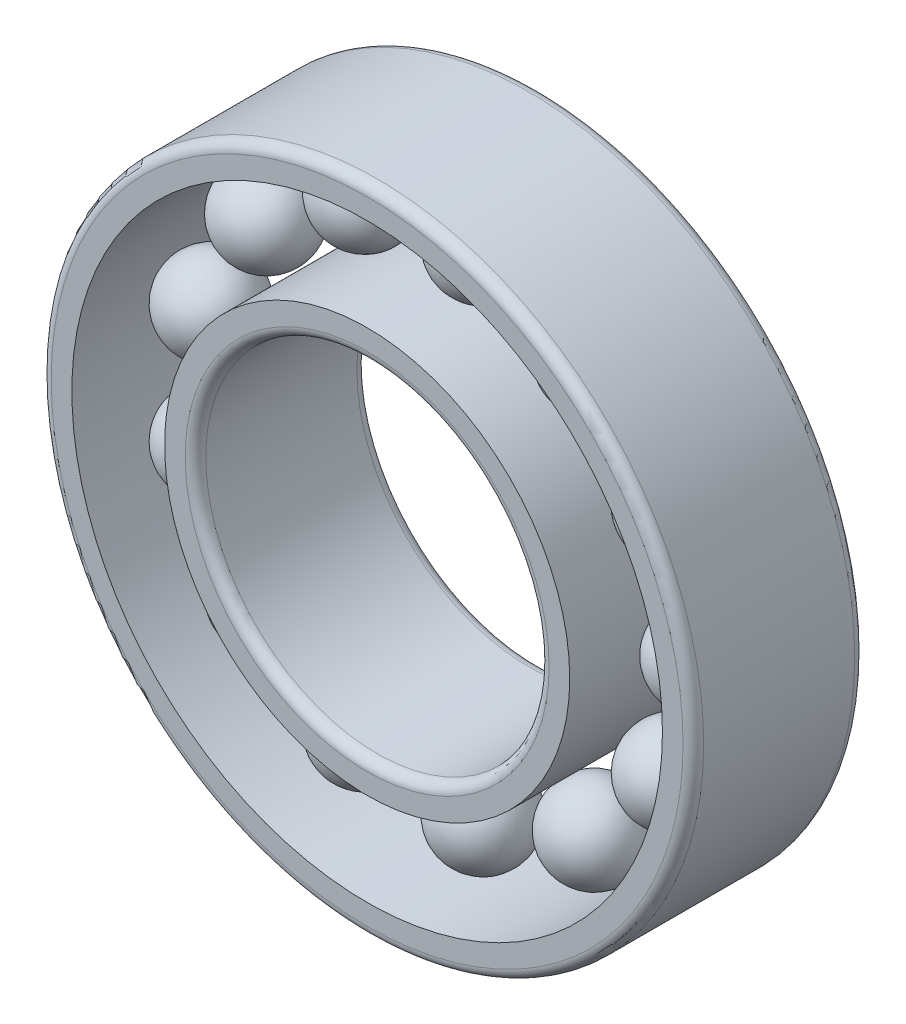
from build123d import *

# Parameters (mm, degrees)
INNERS_W           = 0.9
INNERS_H           = 5
OUTERS_W           = 0.9
OUTERS_H           = 5
BALLSPATTERN_COUNT = 13
FILLET_F1_R        = 0.3
FILLET_F2_R        = 0.3


with BuildPart() as part:
    # InnerS → InnerRing (revolve)
    with BuildSketch(Plane(origin=(0, 0, 0), x_dir=(1, 0, 0), z_dir=(0, 1, 0))):
        with Locations((5.45, 0)):
            Rectangle(INNERS_W, INNERS_H)
    revolve(axis=Axis((0, 0, 4.75), (0, 0, -1)))

    # Fillet F2
    fillet_f2_edges = [part.edges().sort_by_distance(p)[0] for p in [
        (-5, 0, -2.5),
        (-5, 0, 2.5),
    ]]
    fillet(fillet_f2_edges, radius=FILLET_F2_R)


with BuildPart() as body_2:
    # OuterS → OuterRing (revolve)
    with BuildSketch(Plane(origin=(0, 0, 0), x_dir=(1, 0, 0), z_dir=(0, 1, 0))):
        with Locations((9.05, 0)):
            Rectangle(OUTERS_W, OUTERS_H)
    revolve(axis=Axis((0, 0, 4.75), (0, 0, -1)))

    # Fillet F1
    fillet_f1_edges = [body_2.edges().sort_by_distance(p)[0] for p in [
        (-9.5, 0, -2.5),
        (-9.5, 0, 2.5),
    ]]
    fillet(fillet_f1_edges, radius=FILLET_F1_R)


with BuildPart() as body_3:
    # BallS → Ball (revolve)
    with BuildSketch(Plane(origin=(0, 0, 0), x_dir=(1, 0, 0), z_dir=(0, 1, 0))):
        with BuildLine():
            Line((5.9675, 0), (8.5325, 0))
            ThreePointArc((8.5325, 0), (7.25, -1.2825), (5.9675, 0))
        make_face()
    revolve(axis=Axis((5.9675, 0, 0), (1, 0, 0)))


with BuildPart() as ballspattern_1:
    # BallsPattern: pattern copy
    add(body_3.part.rotate(Axis((0, 0, -2.75), (0, 0, 1)), 1 * 360 / BALLSPATTERN_COUNT))


with BuildPart() as ballspattern_2:
    # BallsPattern: pattern copy
    add(body_3.part.rotate(Axis((0, 0, -2.75), (0, 0, 1)), 2 * 360 / BALLSPATTERN_COUNT))


with BuildPart() as ballspattern_3:
    # BallsPattern: pattern copy
    add(body_3.part.rotate(Axis((0, 0, -2.75), (0, 0, 1)), 3 * 360 / BALLSPATTERN_COUNT))


with BuildPart() as ballspattern_4:
    # BallsPattern: pattern copy
    add(body_3.part.rotate(Axis((0, 0, -2.75), (0, 0, 1)), 4 * 360 / BALLSPATTERN_COUNT))


with BuildPart() as ballspattern_5:
    # BallsPattern: pattern copy
    add(body_3.part.rotate(Axis((0, 0, -2.75), (0, 0, 1)), 5 * 360 / BALLSPATTERN_COUNT))


with BuildPart() as ballspattern_6:
    # BallsPattern: pattern copy
    add(body_3.part.rotate(Axis((0, 0, -2.75), (0, 0, 1)), 6 * 360 / BALLSPATTERN_COUNT))


with BuildPart() as ballspattern_7:
    # BallsPattern: pattern copy
    add(body_3.part.rotate(Axis((0, 0, -2.75), (0, 0, 1)), 7 * 360 / BALLSPATTERN_COUNT))


with BuildPart() as ballspattern_8:
    # BallsPattern: pattern copy
    add(body_3.part.rotate(Axis((0, 0, -2.75), (0, 0, 1)), 8 * 360 / BALLSPATTERN_COUNT))


with BuildPart() as ballspattern_9:
    # BallsPattern: pattern copy
    add(body_3.part.rotate(Axis((0, 0, -2.75), (0, 0, 1)), 9 * 360 / BALLSPATTERN_COUNT))


with BuildPart() as ballspattern_10:
    # BallsPattern: pattern copy
    add(body_3.part.rotate(Axis((0, 0, -2.75), (0, 0, 1)), 10 * 360 / BALLSPATTERN_COUNT))


with BuildPart() as ballspattern_11:
    # BallsPattern: pattern copy
    add(body_3.part.rotate(Axis((0, 0, -2.75), (0, 0, 1)), 11 * 360 / BALLSPATTERN_COUNT))


with BuildPart() as ballspattern_12:
    # BallsPattern: pattern copy
    add(body_3.part.rotate(Axis((0, 0, -2.75), (0, 0, 1)), 12 * 360 / BALLSPATTERN_COUNT))


solid = Compound([part.part, body_2.part, body_3.part, ballspattern_1.part, ballspattern_2.part, ballspattern_3.part, ballspattern_4.part, ballspattern_5.part, ballspattern_6.part, ballspattern_7.part, ballspattern_8.part, ballspattern_9.part, ballspattern_10.part, ballspattern_11.part, ballspattern_12.part])
